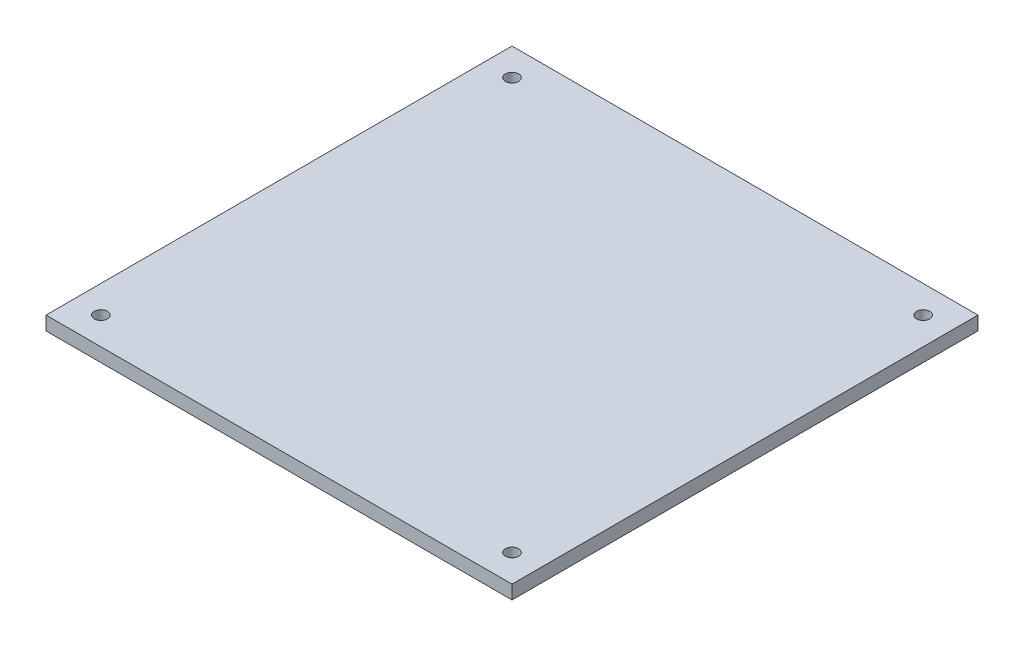
from build123d import *

# Parameters (mm, degrees)
SKETCH1_W           = 85
SKETCH1_H           = 85
BOSS_EXTRUDE1_DEPTH = 2.5
SKETCH2_R           = 1.2
CUT_EXTRUDE3_DEPTH  = 61.156047078


with BuildPart() as part:
    # Sketch1 → Boss-Extrude1 (new body)
    with BuildSketch(Plane(origin=(0, 0, 0), x_dir=(1, 0, 0), z_dir=(0, 1, 0))):
        Rectangle(SKETCH1_W, SKETCH1_H)
    extrude(amount=BOSS_EXTRUDE1_DEPTH)

    # Sketch2 → Cut-Extrude3 (cut, through all)
    with BuildSketch(Plane(origin=(0, 2.5, 0), x_dir=(1, 0, 0), z_dir=(0, 1, 0))):
        with Locations(Location((-37.5, 37.5, 0), (0, 0, 270))):
            Circle(SKETCH2_R)
        with Locations(Location((37.5, 37.5, 0), (0, 0, 270))):
            Circle(SKETCH2_R)
        with Locations(Location((37.5, -37.5, 0), (0, 0, 270))):
            Circle(SKETCH2_R)
        with Locations(Location((-37.5, -37.5, 0), (0, 0, 270))):
            Circle(SKETCH2_R)
    extrude(amount=-CUT_EXTRUDE3_DEPTH, mode=Mode.SUBTRACT)


solid = part.part
